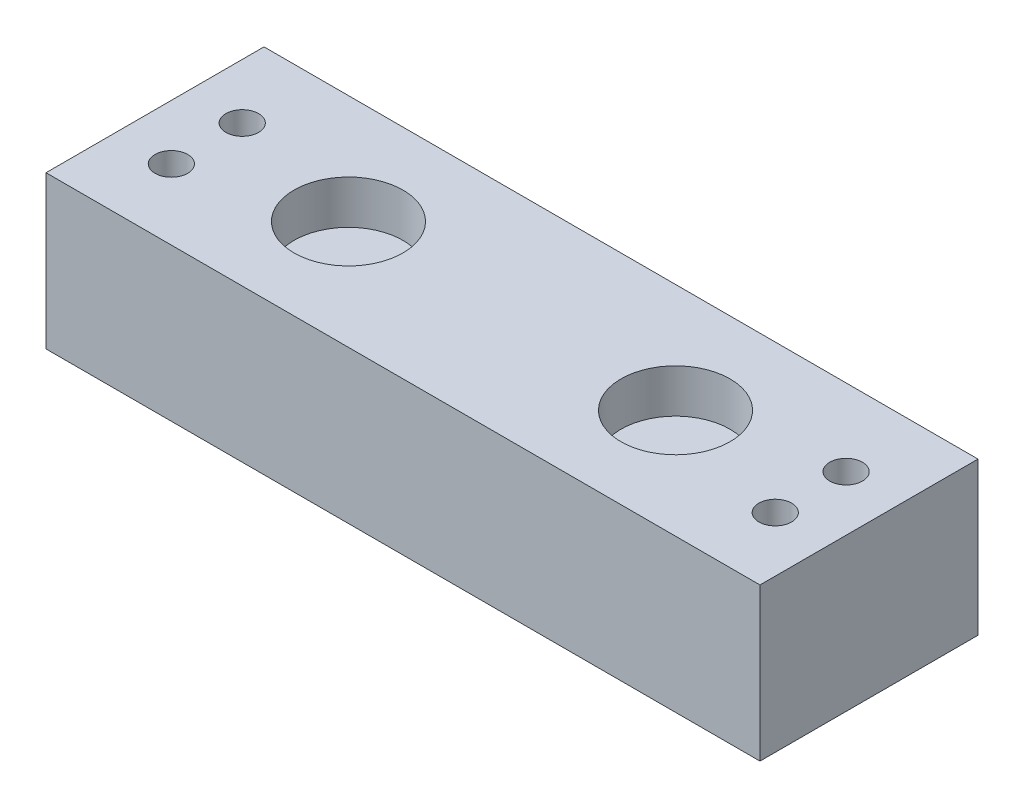
from build123d import *

# Parameters (mm, degrees)
BOSS_EXTRUDE1_DEPTH = 20
SKETCH14_W          = 65.5
SKETCH14_H          = 14
BOSS_EXTRUDE2_DEPTH = 20
SKETCH13_R          = 1.5
CUT_EXTRUDE2_DEPTH  = 54
SKETCH12_R          = 5
CUT_EXTRUDE3_DEPTH  = 4


with BuildPart() as part:
    # Sketch1 → Boss-Extrude1 (new body)
    with BuildSketch(Plane.XY):
        Polygon((26.75, 14), (26.75, 6), (38.75, 6), (38.75, 14), (65.5, 14), (65.5, 0), (0, 0), (0, 14), align=None)
    extrude(amount=BOSS_EXTRUDE1_DEPTH)

    # Sketch14 → Boss-Extrude2 (add)
    with BuildSketch(Plane.XY):
        with Locations((32.75, 7)):
            Rectangle(SKETCH14_W, SKETCH14_H)
    extrude(amount=BOSS_EXTRUDE2_DEPTH)

    # Sketch13 → Cut-Extrude2 (cut)
    with BuildSketch(Plane.XZ):
        with Locations(Location((5.05, 7.05, 0), (0, 0, 270))):
            Circle(SKETCH13_R)
        with Locations(Location((5.05, 13.55, 0), (0, 0, 270))):
            Circle(SKETCH13_R)
        with Locations(Location((60.45, 7.05, 0), (0, 0, 270))):
            Circle(SKETCH13_R)
        with Locations(Location((60.45, 13.55, 0), (0, 0, 270))):
            Circle(SKETCH13_R)
    extrude(amount=-CUT_EXTRUDE2_DEPTH, mode=Mode.SUBTRACT)

    # Sketch12 → Cut-Extrude3 (cut)
    with BuildSketch(Plane(origin=(0, 14, 0), x_dir=(1, 0, 0), z_dir=(0, 1, 0))):
        with Locations(Location((17.75, -10, 0), (0, 0, 270))):
            Circle(SKETCH12_R)
        with Locations(Location((47.75, -10, 0), (0, 0, 90))):
            Circle(SKETCH12_R)
    extrude(amount=-CUT_EXTRUDE3_DEPTH, mode=Mode.SUBTRACT)


solid = part.part
